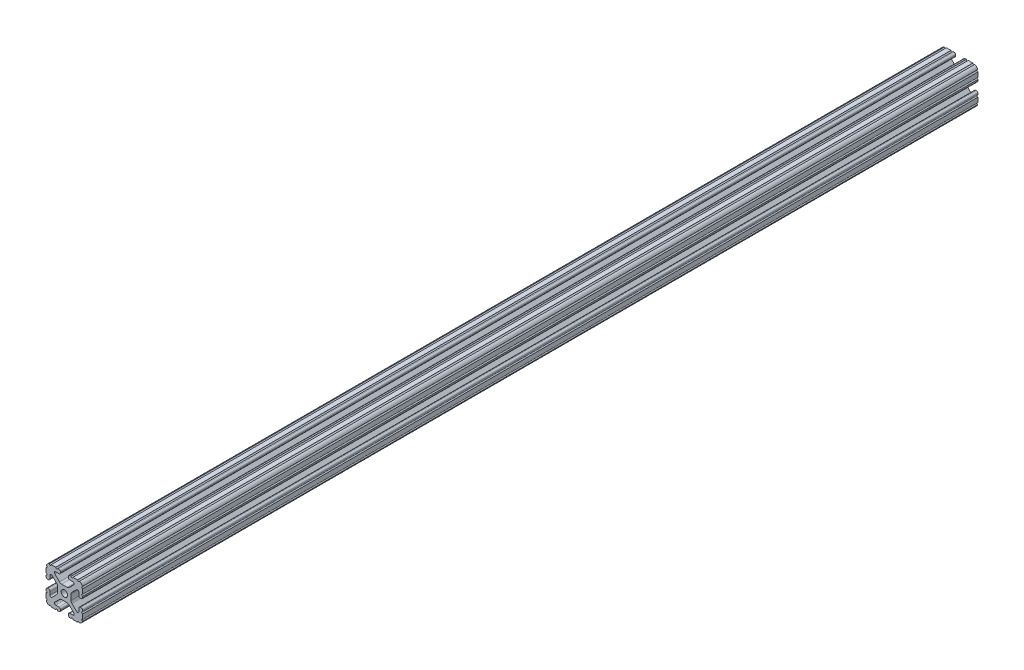
from build123d import *

# Parameters (mm, degrees)
BOSS_EXTRUDE1_DEPTH     = 465
CUT_EXTRUDE1_DEPTH      = 466.779781657
CUT_EXTRUDE1_DEPTH_BACK = 466.779781657
SKETCH5_R               = 1.016


with BuildPart() as part:
    # Sketch4 → Boss-Extrude1 (new, symmetric)
    with BuildSketch(Plane.XY):
        with BuildLine():
            Line((5.7912, -19.05), (14.3002, -19.05))
            ThreePointArc((14.3002, -19.05), (17.658815789, -17.658815789), (19.05, -14.3002))
            Line((19.05, -14.3002), (19.05, -5.7912))
            ThreePointArc((19.05, -5.7912), (18.544114832, -4.569885168), (17.3228, -4.064))
            Line((17.3228, -4.064), (16.7132, -4.064))
            ThreePointArc((16.7132, -4.064), (15.491885168, -4.569885168), (14.986, -5.7912))
            Line((14.986, -5.7912), (14.986, -8.996305235))
            ThreePointArc((14.986, -8.996305235), (14.189232738, -10.188751711), (12.782646215, -9.908964256))
            Line((12.782646215, -9.908964256), (7.888897763, -5.015215804))
            ThreePointArc((7.888897763, -5.015215804), (7.219915375, -4.014012907), (6.985, -2.833013566))
            Line((6.985, -2.833013566), (6.985, 0))
            Line((6.985, 0), (3.3274, 0))
            ThreePointArc((3.3274, 0), (2.352827104, -2.352827104), (0, -3.3274))
            Line((0, -3.3274), (0, -6.985))
            Line((0, -6.985), (2.833013566, -6.985))
            ThreePointArc((2.833013566, -6.985), (4.014012907, -7.219915375), (5.015215804, -7.888897763))
            Line((5.015215804, -7.888897763), (9.908964256, -12.782646215))
            ThreePointArc((9.908964256, -12.782646215), (10.188751711, -14.189232738), (8.996305235, -14.986))
            Line((8.996305235, -14.986), (5.7912, -14.986))
            ThreePointArc((5.7912, -14.986), (4.569885168, -15.491885168), (4.064, -16.7132))
            Line((4.064, -16.7132), (4.064, -17.3228))
            ThreePointArc((4.064, -17.3228), (4.569885168, -18.544114832), (5.7912, -19.05))
        make_face()
    extrude(amount=BOSS_EXTRUDE1_DEPTH, both=True)

    # Sketch5 → Cut-Extrude1 (cut, two sides: drawn at the far end of the back side and taken through both)
    with BuildSketch(Plane.XY.offset(-CUT_EXTRUDE1_DEPTH_BACK)):
        with Locations((14.739477062, -19.05)):
            Circle(SKETCH5_R)
        with Locations((7.980305235, -19.05)):
            Circle(SKETCH5_R)
        with Locations((19.05, -14.739477062)):
            Circle(SKETCH5_R)
        with Locations((19.05, -7.980305235)):
            Circle(SKETCH5_R)
    extrude(amount=CUT_EXTRUDE1_DEPTH + CUT_EXTRUDE1_DEPTH_BACK, mode=Mode.SUBTRACT)

    # Mirror1: part across plane


with BuildPart() as part_1:
    add(part.part)
    add(part.part.mirror(Plane(origin=(0, 0, 0), x_dir=(0, 0, 1), z_dir=(1, 0, 0))))

    # Mirror2: part across plane


with BuildPart() as part_2:
    add(part_1.part)
    add(part_1.part.mirror(Plane.ZX))


solid = part_2.part
